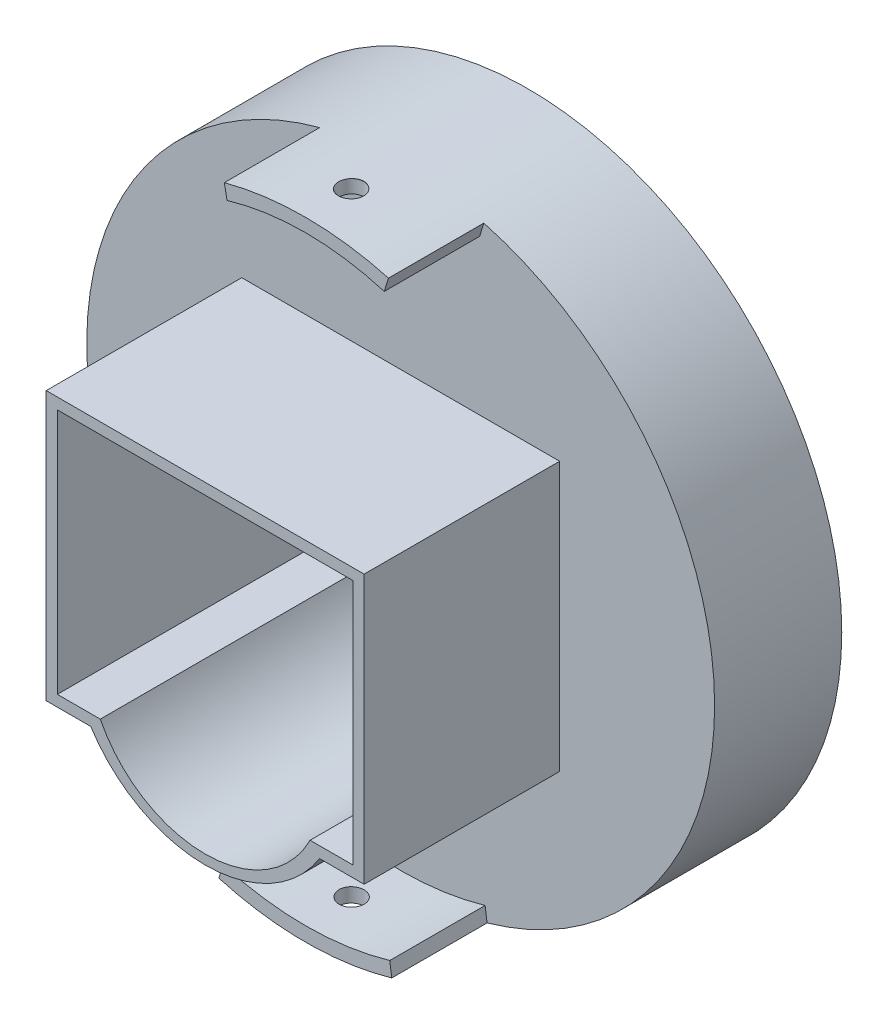
from build123d import *

# Parameters (mm, degrees)
SKETCH1_R                       = 50.165
BOSS_EXTRUDE1_DEPTH             = 20.32
SKETCH4_W                       = 6.858
SKETCH4_H                       = 39.37
BOSS_EXTRUDE3_DEPTH             = 7.62
BOSS_EXTRUDE4_DEPTH             = 31.242
BOSS_EXTRUDE5_DEPTH             = 15.24
F_4_0MM_DOWEL_HOLE1_D           = 4
F_4_0MM_DOWEL_HOLE1_DEPTH       = 3.81
F_4_0MM_DOWEL_HOLE1_CSINK_D     = 4.05
F_4_0MM_DOWEL_HOLE1_CSINK_ANGLE = 100
F_4_0MM_DOWEL_HOLE1_TIP         = 1.201721238
F_4_0MM_DOWEL_HOLE2_D           = 4
F_4_0MM_DOWEL_HOLE2_DEPTH       = 3.81
F_4_0MM_DOWEL_HOLE2_CSINK_D     = 4.05
F_4_0MM_DOWEL_HOLE2_CSINK_ANGLE = 100
F_4_0MM_DOWEL_HOLE2_TIP         = 1.201721238


with BuildPart() as part:
    # Sketch1 → Boss-Extrude1 (new body)
    with BuildSketch(Plane.XY):
        Circle(SKETCH1_R)
        with BuildLine():
            Line((16.764, -19.685), (23.622, -19.685))
            Line((23.622, -19.685), (23.622, 19.685))
            Line((23.622, 19.685), (-23.622, 19.685))
            Line((-23.622, 19.685), (-23.622, -19.685))
            Line((-23.622, -19.685), (-16.764, -19.685))
            ThreePointArc((-16.764, -19.685), (0, -29.98053413), (16.764, -19.685))
        make_face(mode=Mode.SUBTRACT)
    extrude(amount=BOSS_EXTRUDE1_DEPTH)

    # Sketch4 → Boss-Extrude3 (add)
    with BuildSketch(Plane(origin=(0, 0, 0), x_dir=(-1, 0, 0), z_dir=(0, 0, -1))):
        with Locations((-20.193, 0)):
            Rectangle(SKETCH4_W, SKETCH4_H)
        with Locations((20.193, 0)):
            Rectangle(SKETCH4_W, SKETCH4_H)
    extrude(amount=-BOSS_EXTRUDE3_DEPTH)

    # Sketch5 → Boss-Extrude4 (add)
    with BuildSketch(Plane.XY.offset(20.32)):
        with BuildLine():
            ThreePointArc((-18.288, -21.463), (0, -31.496), (18.288, -21.463))
            Line((18.288, -21.463), (25.4, -21.463))
            Line((25.4, -21.463), (25.4, 21.463))
            Line((25.4, 21.463), (-25.4, 21.463))
            Line((-25.4, 21.463), (-25.4, -21.463))
            Line((-25.4, -21.463), (-18.288, -21.463))
        make_face()
        with BuildLine():
            Line((-16.764, -19.685), (-23.622, -19.685))
            Line((-23.622, -19.685), (-23.622, 19.685))
            Line((-23.622, 19.685), (23.622, 19.685))
            Line((23.622, 19.685), (23.622, -19.685))
            Line((23.622, -19.685), (16.764, -19.685))
            ThreePointArc((16.764, -19.685), (0, -29.98053413), (-16.764, -19.685))
        make_face(mode=Mode.SUBTRACT)
    extrude(amount=BOSS_EXTRUDE4_DEPTH)

    # Sketch6 → Boss-Extrude5 (add)
    with BuildSketch(Plane.XY.offset(20.32)):
        with BuildLine():
            Line((13.809066775, -48.226931271), (13.49453303, -45.962673219))
            ThreePointArc((13.49453303, -45.962673219), (0.162084285, -47.884773517), (-13.179792846, -46.029248327))
            Line((-13.179792846, -46.029248327), (-13.809066775, -48.226931271))
            ThreePointArc((-13.809066775, -48.226931271), (0, -50.165), (13.809066775, -48.226931271))
        make_face()
        with BuildLine():
            Line((-12.94251142, 48.466675388), (-12.507062463, 46.222531853))
            ThreePointArc((-12.507062463, 46.222531853), (0.054767522, 48.038227874), (12.611793827, 46.189602713))
            Line((12.611793827, 46.189602713), (13.293700106, 48.371528428))
            ThreePointArc((13.293700106, 48.371528428), (0.181924735, 50.164670121), (-12.94251142, 48.466675388))
        make_face()
    extrude(amount=BOSS_EXTRUDE5_DEPTH)

    # Ø4.0mm Dowel Hole1
    with Locations(Plane(origin=(-0.291325712, 50.164154078, 27.945133858), x_dir=(0.999983137201, 0.005807349979, 0), z_dir=(-0.005807349979, 0.999983137201, 0))):
        with Locations((0, 0)):
            CounterSinkHole(F_4_0MM_DOWEL_HOLE1_D / 2, F_4_0MM_DOWEL_HOLE1_CSINK_D / 2, depth=F_4_0MM_DOWEL_HOLE1_DEPTH, counter_sink_angle=F_4_0MM_DOWEL_HOLE1_CSINK_ANGLE)
            with Locations((0, 0, -(F_4_0MM_DOWEL_HOLE1_DEPTH + F_4_0MM_DOWEL_HOLE1_TIP / 2))):  # 118° drill point
                Cone(0, F_4_0MM_DOWEL_HOLE1_D / 2, F_4_0MM_DOWEL_HOLE1_TIP, mode=Mode.SUBTRACT)

    # Ø4.0mm Dowel Hole2
    with Locations(Plane(origin=(-0.253466909, -50.164359654, 27.907450527), x_dir=(-0.99998723521, 0.005052664379, 0), z_dir=(-0.005052664379, -0.99998723521, 0))):
        with Locations((0, 0)):
            CounterSinkHole(F_4_0MM_DOWEL_HOLE2_D / 2, F_4_0MM_DOWEL_HOLE2_CSINK_D / 2, depth=F_4_0MM_DOWEL_HOLE2_DEPTH, counter_sink_angle=F_4_0MM_DOWEL_HOLE2_CSINK_ANGLE)
            with Locations((0, 0, -(F_4_0MM_DOWEL_HOLE2_DEPTH + F_4_0MM_DOWEL_HOLE2_TIP / 2))):  # 118° drill point
                Cone(0, F_4_0MM_DOWEL_HOLE2_D / 2, F_4_0MM_DOWEL_HOLE2_TIP, mode=Mode.SUBTRACT)


solid = part.part
